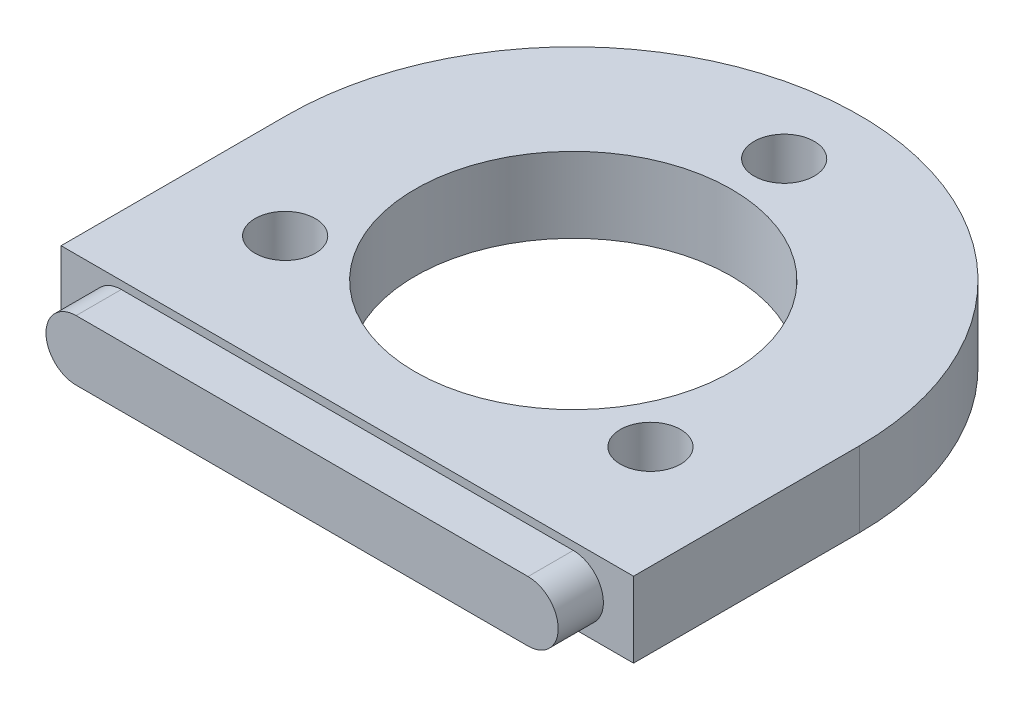
from build123d import *

# Parameters (mm, degrees)
BOSS_EXTRUDE1_DEPTH = 5
BOSS_EXTRUDE2_DEPTH = 3
SKETCH3_R           = 10.5
CUT_EXTRUDE1_DEPTH  = 5
SKETCH4_R           = 2
CUT_EXTRUDE2_DEPTH  = 10
CIRPATTERN1_COUNT   = 3


with BuildPart() as part:
    # Sketch1 → Boss-Extrude1 (new body)
    with BuildSketch(Plane(origin=(0, 0, 0), x_dir=(1, 0, 0), z_dir=(0, 1, 0))):
        with BuildLine():
            Line((19, 0), (19, -15))
            Line((19, -15), (-19, -15))
            Line((-19, -15), (-19, 0))
            ThreePointArc((-19, 0), (0, 19), (19, 0))
        make_face()
    extrude(amount=BOSS_EXTRUDE1_DEPTH)

    # Sketch2 → Boss-Extrude2 (add)
    with BuildSketch(Plane.XY.offset(15)):
        with BuildLine():
            Line((-15, 4.482032097), (15, 4.482032097))
            ThreePointArc((15, 4.482032097), (17, 2.482032097), (15, 0.482032097))
            Line((15, 0.482032097), (-15, 0.482032097))
            ThreePointArc((-15, 0.482032097), (-17, 2.482032097), (-15, 4.482032097))
        make_face()
    extrude(amount=BOSS_EXTRUDE2_DEPTH)

    # Sketch3 → Cut-Extrude1 (cut)
    with BuildSketch(Plane(origin=(0, 5, 0), x_dir=(1, 0, 0), z_dir=(0, 1, 0))):
        with Locations(Location((0, 0, 0), (0, 0, 270))):
            Circle(SKETCH3_R)
    extrude(amount=-CUT_EXTRUDE1_DEPTH, mode=Mode.SUBTRACT)

    # Sketch4 → Cut-Extrude2 (cut)
    with BuildSketch(Plane(origin=(0, 5, 0), x_dir=(1, 0, 0), z_dir=(0, 1, 0))):
        with Locations(Location((0, 14, 0), (0, 0, 270))):
            Circle(SKETCH4_R)
    cut_extrude2 = extrude(amount=-CUT_EXTRUDE2_DEPTH, mode=Mode.SUBTRACT)

    # CirPattern1: Cut-Extrude2 ×3 about axis
    cirpattern1_axis = Axis((0, 0, 0), (0, 1, 0))
    for i in range(1, CIRPATTERN1_COUNT):
        add(cut_extrude2.rotate(cirpattern1_axis, i * 360 / CIRPATTERN1_COUNT), mode=Mode.SUBTRACT)


solid = part.part
